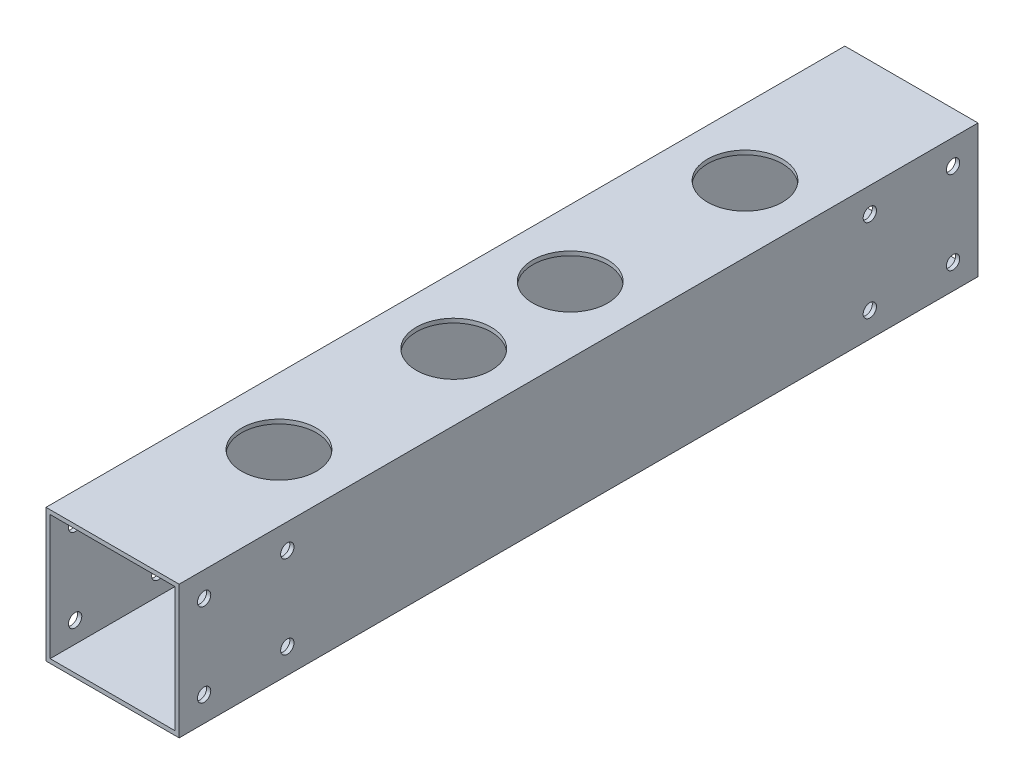
from build123d import *

# Parameters (mm, degrees)
SKETCH2_W               = 50.8
SKETCH2_H               = 50.8
SKETCH2_W_2             = 47.625
SKETCH2_H_2             = 47.625
BOSS_EXTRUDE1_DEPTH     = 304.8
SKETCH3_R               = 14.2875
CUT_EXTRUDE1_DEPTH      = 314.152231351
CUT_EXTRUDE2_DEPTH      = 314.152231351
CUT_EXTRUDE2_DEPTH_BACK = 314.152231351
SKETCH4_R               = 2.54


with BuildPart() as part:
    # Sketch2 → Boss-Extrude1 (new body)
    with BuildSketch(Plane.XY):
        with Locations((25.4, 25.4)):
            Rectangle(SKETCH2_W, SKETCH2_H)
        with Locations((25.4, 25.4)):
            Rectangle(SKETCH2_W_2, SKETCH2_H_2, mode=Mode.SUBTRACT)
    extrude(amount=BOSS_EXTRUDE1_DEPTH)

    # Sketch3 → Cut-Extrude1 (cut, through all)
    with BuildSketch(Plane(origin=(0, 50.8, 0), x_dir=(1, 0, 0), z_dir=(0, 1, 0))):
        with Locations(Location((25.4, -241.3, 0), (0, 0, 270))):
            Circle(SKETCH3_R)
        with Locations(Location((25.4, -174.625, 0), (0, 0, 270))):
            Circle(SKETCH3_R)
        with Locations(Location((25.4, -130.175, 0), (0, 0, 90))):
            Circle(SKETCH3_R)
        with Locations(Location((25.4, -63.5, 0), (0, 0, 90))):
            Circle(SKETCH3_R)
    extrude(amount=-CUT_EXTRUDE1_DEPTH, mode=Mode.SUBTRACT)

    # Sketch4 → Cut-Extrude2 (cut, two sides: drawn at the far end of the back side and taken through both)
    with BuildSketch(Plane.ZY.offset(-CUT_EXTRUDE2_DEPTH_BACK)):
        with Locations((9.525, 41.275)):
            Circle(SKETCH4_R)
        with Locations((9.525, 9.525)):
            Circle(SKETCH4_R)
        with Locations((41.275, 41.275)):
            Circle(SKETCH4_R)
        with Locations((41.275, 9.525)):
            Circle(SKETCH4_R)
        with Locations((263.525, 9.525)):
            Circle(SKETCH4_R)
        with Locations((263.525, 41.275)):
            Circle(SKETCH4_R)
        with Locations((295.275, 9.525)):
            Circle(SKETCH4_R)
        with Locations((295.275, 41.275)):
            Circle(SKETCH4_R)
    extrude(amount=CUT_EXTRUDE2_DEPTH + CUT_EXTRUDE2_DEPTH_BACK, mode=Mode.SUBTRACT)


solid = part.part
